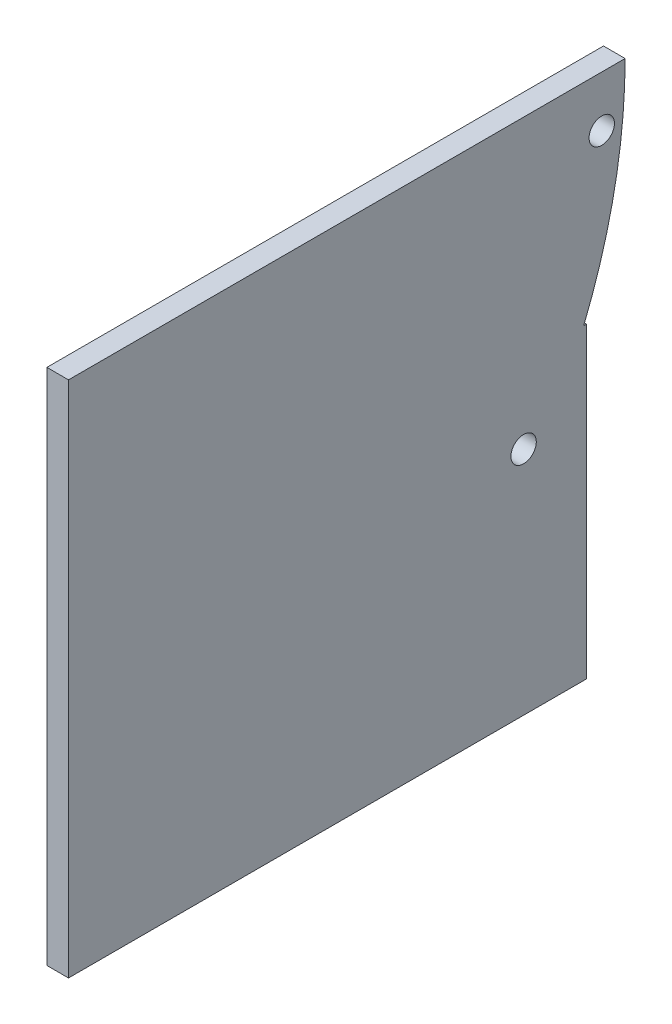
from build123d import *

# Parameters (mm, degrees)
SKETCH1_R           = 3.175
BOSS_EXTRUDE2_DEPTH = 5.4102


with BuildPart() as part:
    # Sketch1 → Boss-Extrude2 (new body)
    with BuildSketch(Plane(origin=(0, 0, 0), x_dir=(0, 0, -1), z_dir=(1, 0, 0))):
        with BuildLine():
            Line((139.192, 0), (0, 0))
            Line((0, 0), (0, -129.54))
            Line((0, -129.54), (129.54, -129.54))
            Line((129.54, -129.54), (129.54, -52.681426173))
            Line((129.54, -52.681426173), (128.837417703, -52.681426173))
            ThreePointArc((128.837417703, -52.681426173), (136.578824693, -26.844692391), (139.192, 0))
        make_face()
        with Locations((113.804702463, -71.909902638)):
            Circle(SKETCH1_R, mode=Mode.SUBTRACT)
        with Locations((133.35, -12.7)):
            Circle(SKETCH1_R, mode=Mode.SUBTRACT)
    extrude(amount=BOSS_EXTRUDE2_DEPTH)


solid = part.part
